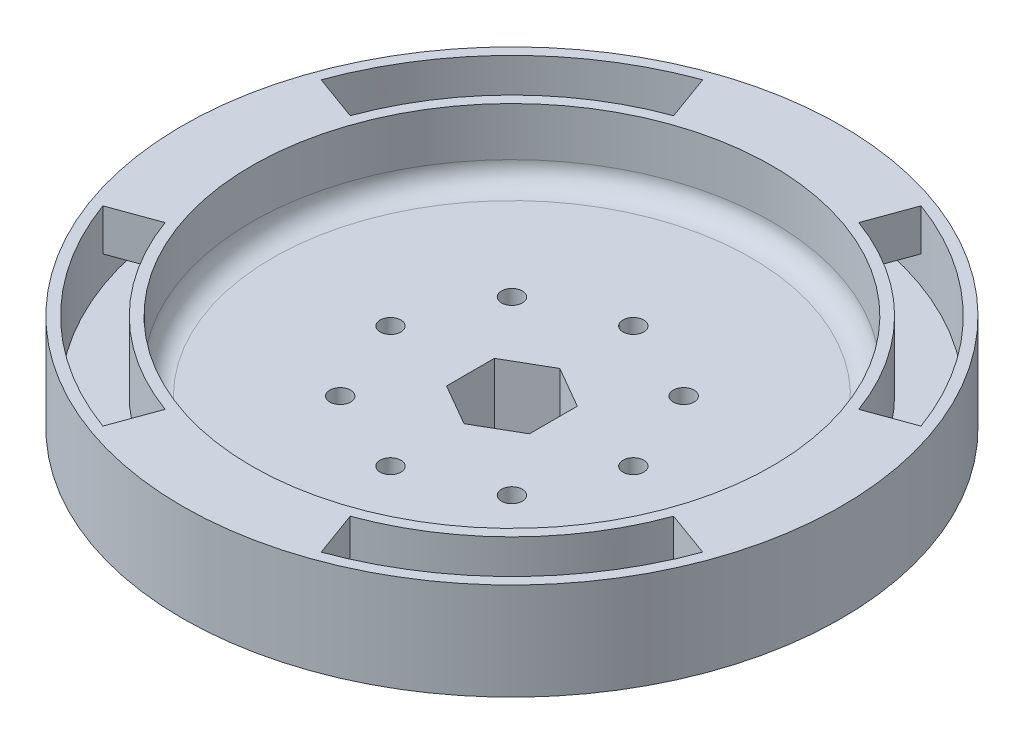
from build123d import *

# Parameters (mm, degrees)
SKETCH_1_R               = 21.5
SKETCH_1_R_2             = 1.5
EXTRUDE_1_DEPTH          = 4
SKETCH_9_R               = 9.75
EXTRUDE_4_DEPTH          = 5
SKETCH_10_R              = 9.75
SKETCH_10_R_2            = 2
EXTRUDE_5_DEPTH          = 5
EXTRUDE_6_DEPTH          = 4
PATTERN_CIRCULAR_1_COUNT = 2
PATTERN_CIRCULAR_1_ANGLE = 60
EXTRUDE_START            = -4
SKETCH_12_R              = 47.5
SKETCH_12_R_2            = 21.5
EXTRUDE_7_DEPTH          = 4
SKETCH_13_R              = 47.5
SKETCH_13_R_2            = 46
SKETCH_13_R_3            = 39
SKETCH_13_R_4            = 37.5
EXTRUDE_8_DEPTH          = 10
EXTRUDE_START_2          = -6
EXTRUDE_9_DEPTH          = 6
FILLET_1_R               = 3


with BuildPart() as part:
    # 草图1 → 凸台-拉伸1 (new body)
    with BuildSketch(Plane(origin=(0, 0, 0), x_dir=(1, 0, 0), z_dir=(0, 1, 0))):
        with Locations(Location((0, 0, 0), (0, 0, 270))):
            Circle(SKETCH_1_R)
        with Locations(Location((12.374368671, 12.374368671, 0), (0, 0, 270))):
            Circle(SKETCH_1_R_2, mode=Mode.SUBTRACT)
        with Locations(Location((12.374368671, -12.374368671, 0), (0, 0, 90))):
            Circle(SKETCH_1_R_2, mode=Mode.SUBTRACT)
        with Locations(Location((-12.374368671, -12.374368671, 0), (0, 0, 270))):
            Circle(SKETCH_1_R_2, mode=Mode.SUBTRACT)
        with Locations(Location((-12.374368671, 12.374368671, 0), (0, 0, 90))):
            Circle(SKETCH_1_R_2, mode=Mode.SUBTRACT)
        with Locations(Location((0, 17.5, 0), (0, 0, 90))):
            Circle(SKETCH_1_R_2, mode=Mode.SUBTRACT)
        with Locations(Location((17.5, 0, 0), (0, 0, 270))):
            Circle(SKETCH_1_R_2, mode=Mode.SUBTRACT)
        with Locations(Location((0, -17.5, 0), (0, 0, 90))):
            Circle(SKETCH_1_R_2, mode=Mode.SUBTRACT)
        with Locations(Location((-17.5, 0, 0), (0, 0, 270))):
            Circle(SKETCH_1_R_2, mode=Mode.SUBTRACT)
        Polygon((0, 6.899335717), (-5.975, 3.449667858), (-5.975, -3.449667858), (0, -6.899335717), (5.975, -3.449667858), (5.975, 3.449667858), align=None, mode=Mode.SUBTRACT)
    extrude(amount=EXTRUDE_1_DEPTH)

    # 草图9 → 凸台-拉伸4 (add)
    with BuildSketch(Plane.XZ):
        with Locations(Location((0, 0, 0), (0, 0, 270))):
            Circle(SKETCH_9_R)
        Polygon((-5.975, -3.449667858), (-5.975, 3.449667858), (0, 6.899335717), (5.975, 3.449667858), (5.975, -3.449667858), (0, -6.899335717), align=None, mode=Mode.SUBTRACT)
    extrude(amount=EXTRUDE_4_DEPTH)

    # 草图10 → 凸台-拉伸5 (add)
    with BuildSketch(Plane.XZ.offset(5)):
        with Locations(Location((0, 0, 0), (0, 0, 270))):
            Circle(SKETCH_10_R)
        with Locations(Location((0, 0, 0), (0, 0, 270))):
            Circle(SKETCH_10_R_2, mode=Mode.SUBTRACT)
    extrude(amount=EXTRUDE_5_DEPTH)

    # 草图11 → 凸台-拉伸6 (add)
    with BuildSketch(Plane.XZ.offset(10)):
        with BuildLine():
            Line((-7.899218714, -5.715316589), (-3.742640687, -3.315515147))
            ThreePointArc((-3.742640687, -3.315515147), (-4.330127019, -2.5), (-4.742640687, -1.583464339))
            Line((-4.742640687, -1.583464339), (-8.899218714, -3.983265782))
            ThreePointArc((-8.899218714, -3.983265782), (-8.443747687, -4.875), (-7.899218714, -5.715316589))
        make_face()
        with BuildLine():
            ThreePointArc((-1, 4.898979486), (0, 5), (1, 4.898979486))
            Line((1, 4.898979486), (1, 9.698582371))
            ThreePointArc((1, 9.698582371), (0, 9.75), (-1, 9.698582371))
            Line((-1, 9.698582371), (-1, 4.898979486))
        make_face()
        with BuildLine():
            Line((8.899218714, -3.983265782), (4.742640687, -1.583464339))
            ThreePointArc((4.742640687, -1.583464339), (4.330127019, -2.5), (3.742640687, -3.315515147))
            Line((3.742640687, -3.315515147), (7.899218714, -5.715316589))
            ThreePointArc((7.899218714, -5.715316589), (8.443747687, -4.875), (8.899218714, -3.983265782))
        make_face()
    extrude_6 = extrude(amount=EXTRUDE_6_DEPTH)

    # 阵列(圆周)1: 凸台-拉伸6 ×2 about axis
    pattern_circular_1_axis = Axis((0, 0, 0), (0, -1, 0))
    for i in range(1, PATTERN_CIRCULAR_1_COUNT):
        add(extrude_6.rotate(pattern_circular_1_axis, i * PATTERN_CIRCULAR_1_ANGLE / (PATTERN_CIRCULAR_1_COUNT - 1)))

    # 草图12 → 凸台-拉伸7 (add)
    with BuildSketch(Plane(origin=(0, 4, 0), x_dir=(1, 0, 0), z_dir=(0, 1, 0)).offset(EXTRUDE_START)):
        with Locations(Location((0, 0, 0), (0, 0, 270))):
            Circle(SKETCH_12_R)
        Circle(SKETCH_12_R_2, mode=Mode.SUBTRACT)
    extrude(amount=EXTRUDE_7_DEPTH)

    # 草图13 → 凸台-拉伸8 (add)
    # profile 1 of 2: a face of its own
    with BuildSketch(Plane(origin=(0, 4, 0), x_dir=(1, 0, 0), z_dir=(0, 1, 0))):
        with Locations(Location((0, 0, 0), (0, 0, 270))):
            Circle(SKETCH_13_R)
        with Locations(Location((0, 0, 0), (0, 0, 270))):
            Circle(SKETCH_13_R_2, mode=Mode.SUBTRACT)
    # profile 2 of 2: a face of its own
    with BuildSketch(Plane(origin=(0, 4, 0), x_dir=(1, 0, 0), z_dir=(0, 1, 0))):
        with Locations(Location((0, 0, 0), (0, 0, 270))):
            Circle(SKETCH_13_R_3)
        with Locations(Location((0, 0, 0), (0, 0, 270))):
            Circle(SKETCH_13_R_4, mode=Mode.SUBTRACT)
    extrude(amount=EXTRUDE_8_DEPTH)

    # 草图14 → 凸台-拉伸9 (add)
    with BuildSketch(Plane(origin=(0, 14, 0), x_dir=(1, 0, 0), z_dir=(0, 1, 0)).offset(EXTRUDE_START_2)):
        with BuildLine():
            Line((-15.732926593, 43.225860556), (-13.33878559, 36.648012211))
            ThreePointArc((-13.33878559, 36.648012211), (0, 39), (13.33878559, 36.648012211))
            Line((13.33878559, 36.648012211), (15.732926593, 43.225860556))
            ThreePointArc((15.732926593, 43.225860556), (0, 46), (-15.732926593, 43.225860556))
        make_face()
        with BuildLine():
            Line((43.225860556, -15.732926593), (36.648012211, -13.33878559))
            ThreePointArc((36.648012211, -13.33878559), (39, 0), (36.648012211, 13.33878559))
            Line((36.648012211, 13.33878559), (43.225860556, 15.732926593))
            ThreePointArc((43.225860556, 15.732926593), (46, 0), (43.225860556, -15.732926593))
        make_face()
        with BuildLine():
            Line((-15.732926593, -43.225860556), (-13.33878559, -36.648012211))
            ThreePointArc((-13.33878559, -36.648012211), (0, -39), (13.33878559, -36.648012211))
            Line((13.33878559, -36.648012211), (15.732926593, -43.225860556))
            ThreePointArc((15.732926593, -43.225860556), (0, -46), (-15.732926593, -43.225860556))
        make_face()
        with BuildLine():
            Line((-43.225860556, 15.732926593), (-36.648012211, 13.33878559))
            ThreePointArc((-36.648012211, 13.33878559), (-39, 0), (-36.648012211, -13.33878559))
            Line((-36.648012211, -13.33878559), (-43.225860556, -15.732926593))
            ThreePointArc((-43.225860556, -15.732926593), (-46, 0), (-43.225860556, 15.732926593))
        make_face()
    extrude(amount=EXTRUDE_9_DEPTH)

    # 圆角1
    fillet_1_edges = [part.edges().sort_by_distance(p)[0] for p in [
        (0, 4, -37.5),
    ]]
    fillet(fillet_1_edges, radius=FILLET_1_R)


solid = part.part
